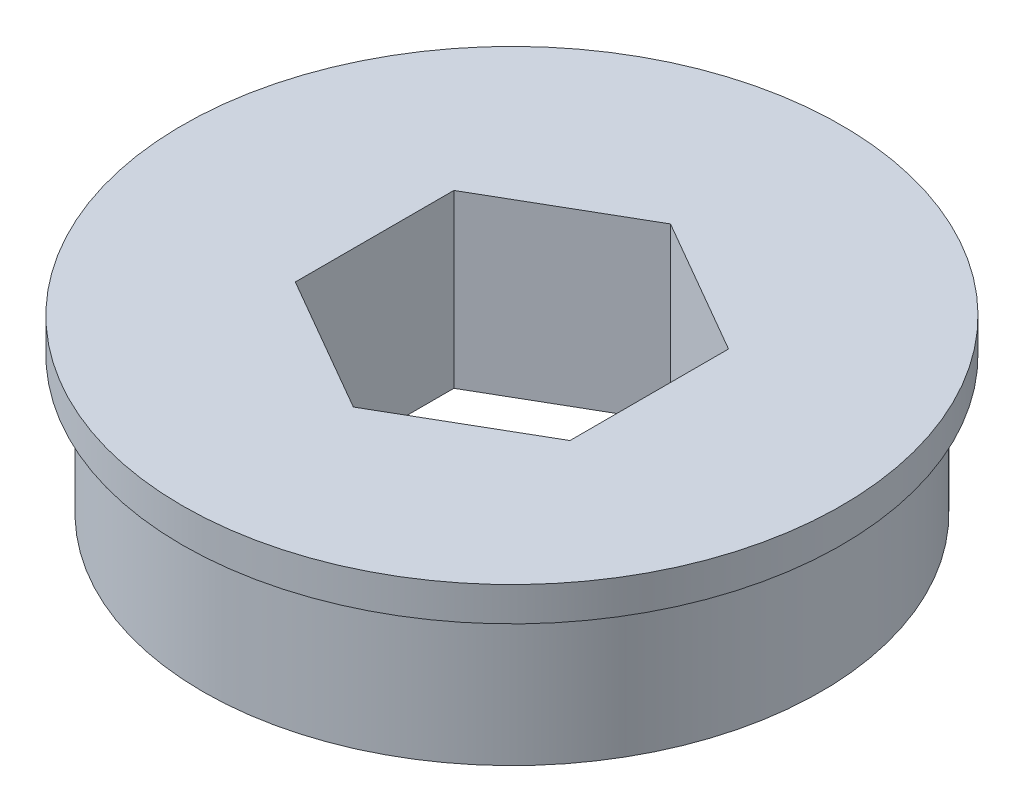
from build123d import *

# Parameters (mm, degrees)
SKETCH1_R           = 14.2875
BOSS_EXTRUDE1_DEPTH = 6.35
SKETCH2_R           = 15.24
BOSS_EXTRUDE2_DEPTH = 1.5748


with BuildPart() as part:
    # Sketch1 → Boss-Extrude1 (new body)
    with BuildSketch(Plane(origin=(0, 0, 0), x_dir=(1, 0, 0), z_dir=(0, 1, 0))):
        with Locations(Location((0, 0, 0), (0, 0, 270))):
            Circle(SKETCH1_R)
        Polygon((0, -7.332348419), (6.35, -3.666174209), (6.35, 3.666174209), (0, 7.332348419), (-6.35, 3.666174209), (-6.35, -3.666174209), align=None, mode=Mode.SUBTRACT)
    extrude(amount=BOSS_EXTRUDE1_DEPTH)

    # Sketch2 → Boss-Extrude2 (add)
    with BuildSketch(Plane(origin=(0, 6.35, 0), x_dir=(1, 0, 0), z_dir=(0, 1, 0))):
        with Locations(Location((0, 0, 0), (0, 0, 270))):
            Circle(SKETCH2_R)
        Polygon((0, 7.332348419), (-6.35, 3.666174209), (-6.35, -3.666174209), (0, -7.332348419), (6.35, -3.666174209), (6.35, 3.666174209), align=None, mode=Mode.SUBTRACT)
    extrude(amount=BOSS_EXTRUDE2_DEPTH)


solid = part.part
